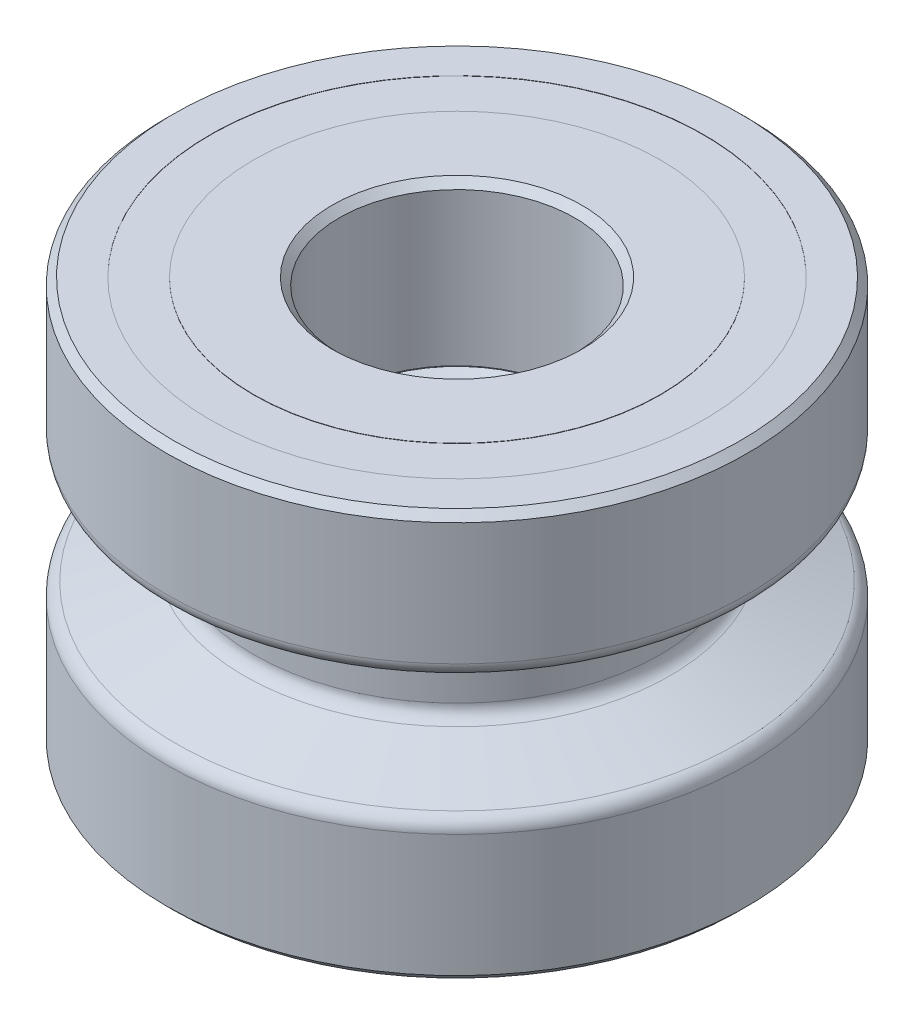
from build123d import *

# Parameters (mm, degrees)
SKETCH1_R           = 10
BOSS_EXTRUDE1_DEPTH = 7
CUT_EXTRUDE1_REACH  = 21.9
SKETCH2_R           = 3.5
FILLET4_R           = 0.5
SKETCH11_R          = 4.05
CUT_EXTRUDE2_DEPTH  = 2.5
CUT_EXTRUDE3_START  = -5.5
SKETCH12_R          = 4.05
CUT_EXTRUDE3_DEPTH  = 5.5
CUT_EXTRUDE4_START  = -0.01
SKETCH13_R          = 8.5
SKETCH13_R_2        = 7
CUT_EXTRUDE4_DEPTH  = 0.01
CHAMFER1_SIZE       = 0.25
CHAMFER2_SIZE       = 0.3
CHAMFER2_SIZE2      = 0.519615242


with BuildPart() as part:
    # Sketch1 → Boss-Extrude1 (new, symmetric)
    with BuildSketch(Plane(origin=(0, 0, 0), x_dir=(1, 0, 0), z_dir=(0, 1, 0))):
        with Locations(Location((0, 0, 0), (0, 0, 270))):
            Circle(SKETCH1_R)
    extrude(amount=BOSS_EXTRUDE1_DEPTH, both=True)

    # Sketch2 → Cut-Extrude1 (cut, up to next)
    with BuildSketch(Plane.XZ.offset(7), mode=Mode.PRIVATE) as cut_extrude1_sk1:
        with Locations(Location((0, 0, 0), (0, 0, 270))):
            Circle(SKETCH2_R)
    cut_extrude1_tool1 = extrude(cut_extrude1_sk1.sketch, amount=-CUT_EXTRUDE1_REACH, mode=Mode.PRIVATE) & part.part
    add(cut_extrude1_tool1.solids().sort_by_distance((0, -7, 0))[0], mode=Mode.SUBTRACT)

    # Sketch10 → Cut-Revolve1 (revolve, cut)
    with BuildSketch(Plane.XY, mode=Mode.PRIVATE) as cut_revolve1_sk:
        Polygon((10, 2.191910703), (7, 1.1), (7, -1.1), (10, -2.191910703), align=None)
    revolve(cut_revolve1_sk.sketch.rotate(Axis((0, 7, 0), (0, -1, 0)), 90), axis=Axis((0, 7, 0), (0, -1, 0)), mode=Mode.SUBTRACT)

    # Fillet4
    fillet4_edges = [part.edges().sort_by_distance(p)[0] for p in [
        (0, -2.191910703, -10),
        (0, -1.1, -7),
        (0, 1.1, -7),
        (0, 2.191910703, -10),
    ]]
    fillet(fillet4_edges, radius=FILLET4_R)

    # Sketch11 → Cut-Extrude2 (cut)
    with BuildSketch(Plane.XZ.offset(7)):
        with Locations(Location((0, 0, 0), (0, 0, 270))):
            Circle(SKETCH11_R)
    extrude(amount=-CUT_EXTRUDE2_DEPTH, mode=Mode.SUBTRACT)

    # Sketch12 → Cut-Extrude3 (cut)
    with BuildSketch(Plane(origin=(0, 7, 0), x_dir=(1, 0, 0), z_dir=(0, 1, 0)).offset(CUT_EXTRUDE3_START)):
        with Locations(Location((0, 0, 0), (0, 0, 90))):
            Circle(SKETCH12_R)
    extrude(amount=CUT_EXTRUDE3_DEPTH, mode=Mode.SUBTRACT)

    # Sketch13 → Cut-Extrude4 (cut)
    with BuildSketch(Plane(origin=(0, 7, 0), x_dir=(1, 0, 0), z_dir=(0, 1, 0)).offset(CUT_EXTRUDE4_START)):
        with Locations(Location((0, 0, 0), (0, 0, 270))):
            Circle(SKETCH13_R)
        with Locations(Location((0, 0, 0), (0, 0, 270))):
            Circle(SKETCH13_R_2, mode=Mode.SUBTRACT)
    extrude(amount=CUT_EXTRUDE4_DEPTH, mode=Mode.SUBTRACT)

    # Chamfer1
    chamfer1_edges = [part.edges().sort_by_distance(p)[0] for p in [
        (0, -7, -10),
        (0, -7, 4.05),
        (0, 7, 4.05),
        (0, 7, -10),
    ]]
    chamfer(chamfer1_edges, length=CHAMFER1_SIZE)

    # Chamfer2
    chamfer2_edges = [part.edges().sort_by_distance(p)[0] for p in [
        (0, 1.5, 3.5),
    ]]
    chamfer2_side = [part.faces().sort_by_distance(p)[0] for p in [
        (0, -1.5, 3.5),
    ]]
    chamfer(chamfer2_edges, length=CHAMFER2_SIZE, length2=CHAMFER2_SIZE2, reference=chamfer2_side[0])


solid = part.part
